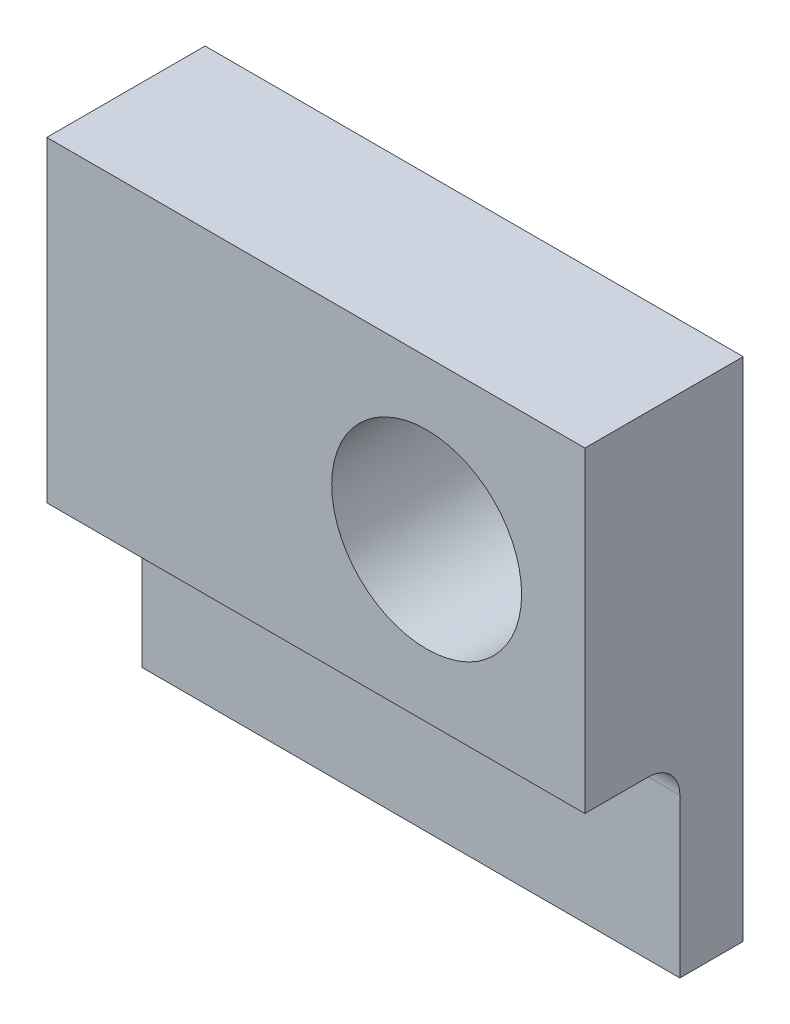
from build123d import *

# Parameters (mm, degrees)
ESQUISSE1_W        = 17
ESQUISSE1_H        = 10
ESQUISSE1_R        = 3
BOSS_EXTRU_1_DEPTH = 5
ESQUISSE2_W        = 17
ESQUISSE2_H        = 6
BOSS_EXTRU_2_DEPTH = 2
CONG_1_R           = 1


with BuildPart() as part:
    # Esquisse1 → Boss.-Extru.1 (new body)
    with BuildSketch(Plane.XY):
        with Locations((8.5, 5)):
            Rectangle(ESQUISSE1_W, ESQUISSE1_H)
        with Locations((12, 5)):
            Circle(ESQUISSE1_R, mode=Mode.SUBTRACT)
    extrude(amount=BOSS_EXTRU_1_DEPTH)

    # Esquisse2 → Boss.-Extru.2 (add)
    with BuildSketch(Plane(origin=(0, 0, 0), x_dir=(-1, 0, 0), z_dir=(0, 0, -1))):
        with Locations((-8.5, -3)):
            Rectangle(ESQUISSE2_W, ESQUISSE2_H)
    extrude(amount=-BOSS_EXTRU_2_DEPTH)

    # Congé1
    cong_1_edges = [part.edges().sort_by_distance(p)[0] for p in [
        (8.5, 0, 2),
    ]]
    fillet(cong_1_edges, radius=CONG_1_R)


solid = part.part
